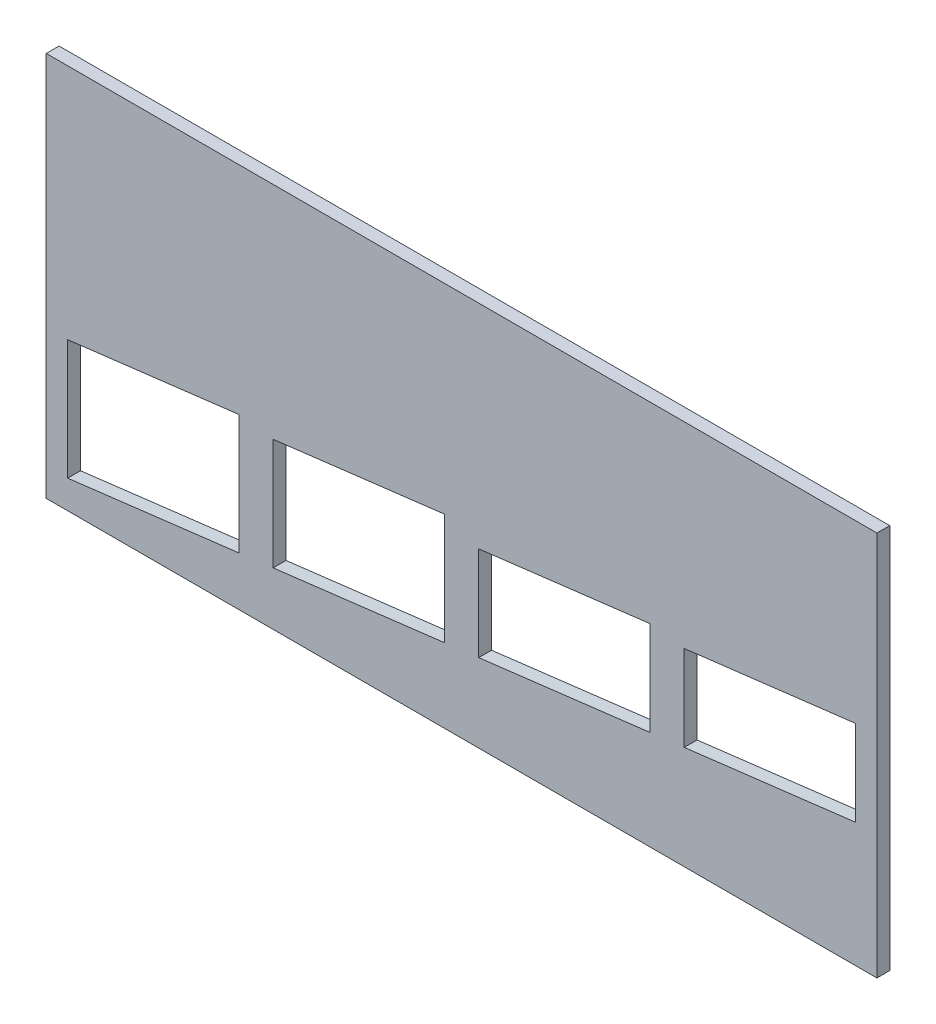
from build123d import *

# Parameters (mm, degrees)
SKETCH_1_W      = 194
SKETCH_1_H      = 90
EXTRUDE_1_DEPTH = 3


with BuildPart() as part:
    # 草圖1 → 填料-伸長1 (new body)
    with BuildSketch(Plane.XY):
        with Locations((-1.5, 0.009137056)):
            Rectangle(SKETCH_1_W, SKETCH_1_H)
        Polygon((50.5, -20.847715736), (50.5, -0.847715736), (90.5, 4.009137056), (90.5, -15.990862944), align=None, mode=Mode.SUBTRACT)
        Polygon((2.5, -26.695431472), (2.5, -4.695431472), (42.5, 0.177664975), (42.5, -21.822335025), align=None, mode=Mode.SUBTRACT)
        Polygon((-45.5, -32.543147208), (-45.5, -6.543147208), (-5.5, -1.670050761), (-5.5, -27.670050761), align=None, mode=Mode.SUBTRACT)
        Polygon((-93.5, -38.390862944), (-93.5, -10.390862944), (-53.5, -5.517766497), (-53.5, -33.517766497), align=None, mode=Mode.SUBTRACT)
    extrude(amount=EXTRUDE_1_DEPTH)


solid = part.part
